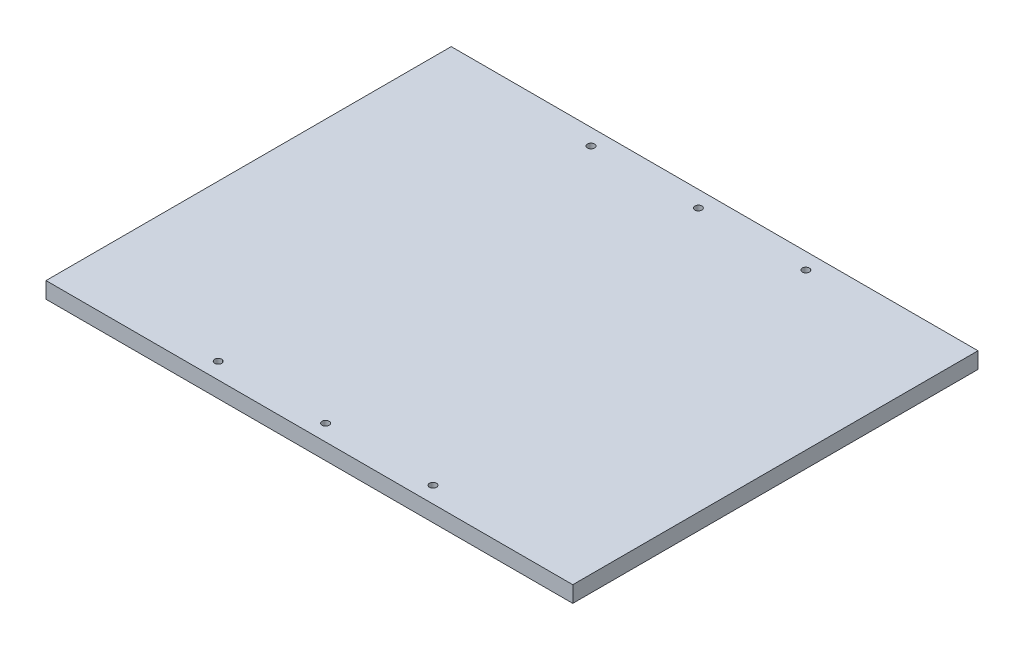
from build123d import *

# Parameters (mm, degrees)
SKIZZE1_W                       = 260
SKIZZE1_H                       = 200
SKIZZE1_R                       = 1.75
AUFSATZ_LINEAR_AUSTRAGEN1_DEPTH = 8


with BuildPart() as part:
    # Skizze1 → Aufsatz-Linear austragen1 (new body)
    with BuildSketch(Plane(origin=(0, 0, 0), x_dir=(1, 0, 0), z_dir=(0, 1, 0))):
        Rectangle(SKIZZE1_W, SKIZZE1_H)
        with Locations(Location((-53, -92, 0), (0, 0, 270))):
            Circle(SKIZZE1_R, mode=Mode.SUBTRACT)
        with Locations(Location((53, -92, 0), (0, 0, 270))):
            Circle(SKIZZE1_R, mode=Mode.SUBTRACT)
        with Locations(Location((0, -92, 0), (0, 0, 270))):
            Circle(SKIZZE1_R, mode=Mode.SUBTRACT)
        with Locations(Location((0, 92, 0), (0, 0, 90))):
            Circle(SKIZZE1_R, mode=Mode.SUBTRACT)
        with Locations(Location((53, 92, 0), (0, 0, 90))):
            Circle(SKIZZE1_R, mode=Mode.SUBTRACT)
        with Locations(Location((-53, 92, 0), (0, 0, 90))):
            Circle(SKIZZE1_R, mode=Mode.SUBTRACT)
    extrude(amount=AUFSATZ_LINEAR_AUSTRAGEN1_DEPTH)


solid = part.part
